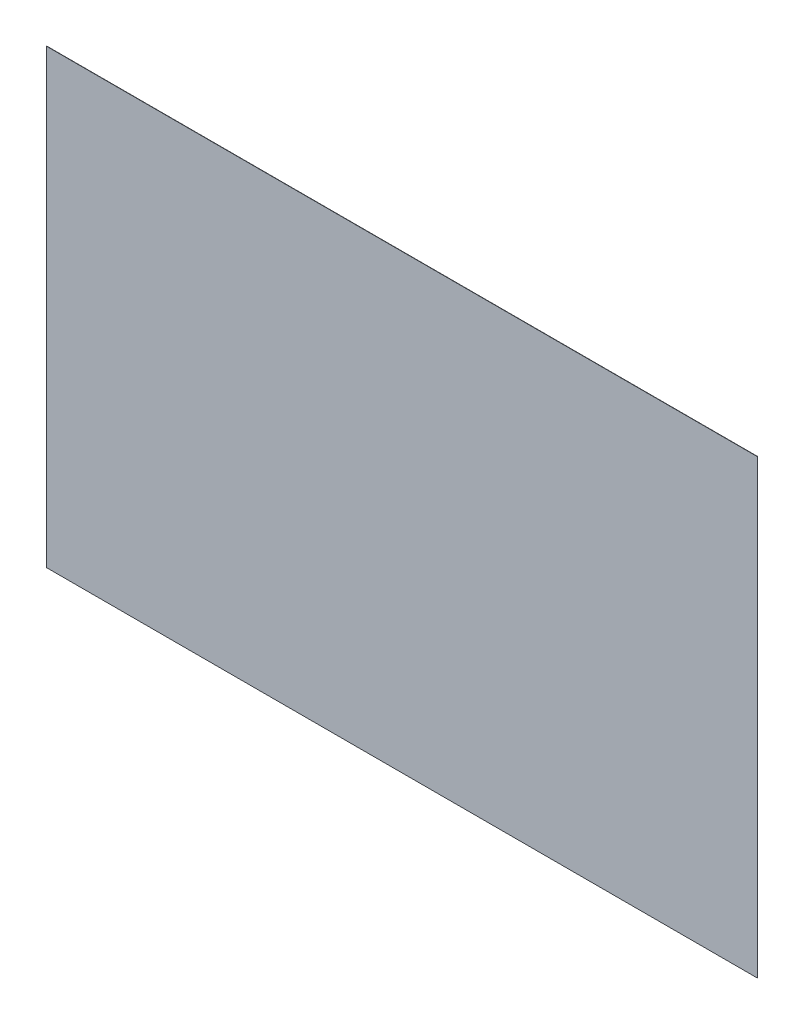
from build123d import *

# Parameters (mm, degrees)
SKETCH1_W           = 2440
SKETCH1_H           = 1550
BOSS_EXTRUDE1_DEPTH = 1


with BuildPart() as part:
    # Sketch1 → Boss-Extrude1 (new body)
    with BuildSketch(Plane.XY):
        with Locations((1220, 775)):
            Rectangle(SKETCH1_W, SKETCH1_H)
    extrude(amount=BOSS_EXTRUDE1_DEPTH)


solid = part.part
